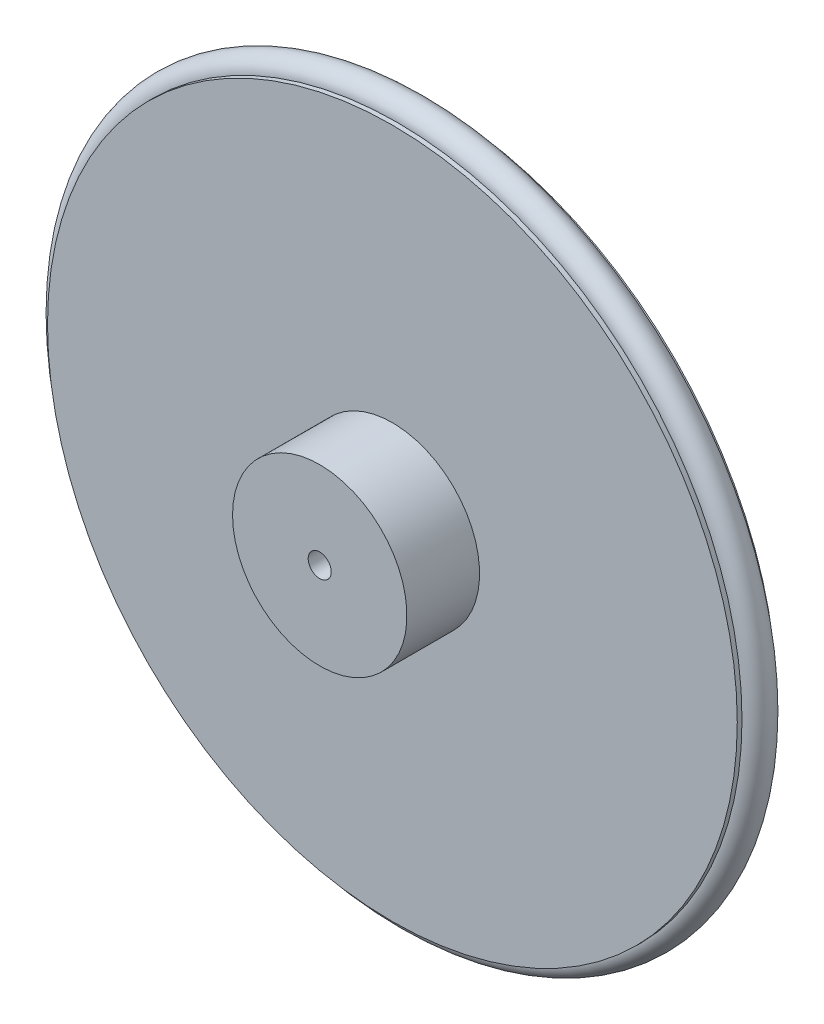
from build123d import *


with BuildPart() as part:
    # Esquisse1 → Révolution1 (revolve)
    with BuildSketch(Plane(origin=(0, 0, 0), x_dir=(1, 0, 0), z_dir=(0, 1, 0)), mode=Mode.PRIVATE) as r_volution1_sk:
        with BuildLine():
            Line((29.9, 17.303746522), (29.9, 17.713746522))
            Line((29.9, 17.713746522), (0, 17.713746522))
            Line((0, 17.713746522), (0, 17.052896028))
            Line((0, 17.052896028), (1, 17.052896028))
            Line((1, 17.052896028), (1, 8.013746522))
            Line((1, 8.013746522), (7.558685201, 8.013746522))
            Line((7.558685201, 8.013746522), (7.558685201, 14.313746522))
            Line((7.558685201, 14.313746522), (29.9, 14.313746522))
            Line((29.9, 14.313746522), (29.9, 14.723746522))
            ThreePointArc((29.9, 14.723746522), (31.19, 16.013746522), (29.9, 17.303746522))
        make_face()
    revolve(r_volution1_sk.sketch.rotate(Axis((0, 0, -20.028610737), (0, 0, 1)), 180), axis=Axis((0, 0, -20.028610737), (0, 0, 1)))


solid = part.part
